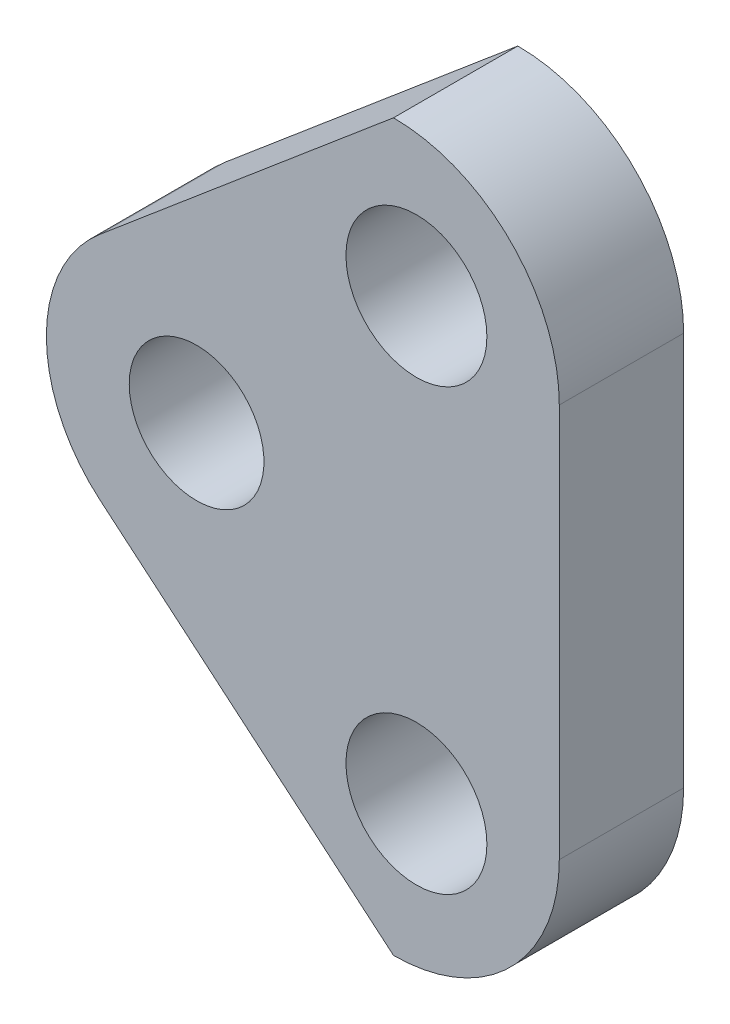
from build123d import *

# Parameters (mm, degrees)
SKETCH_1_R          = 3.4
EXTRUDE_1_DEPTH     = 11
SKETCH_2_R          = 3.4
EXTRUDE_2_DEPTH     = 3
SKETCH_3_R          = 3.4
CUT_EXTRUDE_1_DEPTH = 28.083205128
CUT_EXTRUDE_START   = -5
SKETCH_4_R          = 6
SKETCH_4_R_2        = 3.4
CUT_EXTRUDE_2_DEPTH = 5
CUT_EXTRUDE_3_DEPTH = 28.083205128
CUT_EXTRUDE_5_DEPTH = 28.083205128
CUT_EXTRUDE_6_DEPTH = 5
SKETCH_9_R          = 6
SKETCH_9_R_2        = 3.4
CUT_EXTRUDE_7_DEPTH = 10
CUT_EXTRUDE_8_DEPTH = 10
SKETCH_11_R         = 6
SKETCH_11_R_2       = 3.25
EXTRUDE_3_DEPTH     = 6


with BuildPart() as part:
    # 草图1 → 凸台-拉伸1 (new body)
    with BuildSketch(Plane.XY):
        with BuildLine():
            Line((-9.5, -17.5), (9.5, -17.5))
            ThreePointArc((9.5, -17.5), (15.156854249, -15.156854249), (17.5, -9.5))
            Line((17.5, -9.5), (17.5, 9.5))
            ThreePointArc((17.5, 9.5), (15.156854249, 15.156854249), (9.5, 17.5))
            Line((9.5, 17.5), (-9.5, 17.5))
            ThreePointArc((-9.5, 17.5), (-15.156854249, 15.156854249), (-17.5, 9.5))
            Line((-17.5, 9.5), (-17.5, -9.5))
            ThreePointArc((-17.5, -9.5), (-15.156854249, -15.156854249), (-9.5, -17.5))
        make_face()
        with Locations((10.606601718, 10.606601718)):
            Circle(SKETCH_1_R, mode=Mode.SUBTRACT)
        with Locations((10.606601718, -10.606601718)):
            Circle(SKETCH_1_R, mode=Mode.SUBTRACT)
        with Locations((-10.606601718, -10.606601718)):
            Circle(SKETCH_1_R, mode=Mode.SUBTRACT)
        with Locations((-10.606601718, 10.606601718)):
            Circle(SKETCH_1_R, mode=Mode.SUBTRACT)
    extrude(amount=EXTRUDE_1_DEPTH)

    # 草图2 → 凸台-拉伸2 (add)
    with BuildSketch(Plane(origin=(0, 0, 0), x_dir=(-1, 0, 0), z_dir=(0, 0, -1))):
        with Locations((10.606601718, -10.606601718)):
            Circle(SKETCH_2_R)
        with Locations((-10.606601718, -10.606601718)):
            Circle(SKETCH_2_R)
        with Locations((10.606601718, 10.606601718)):
            Circle(SKETCH_2_R)
        with Locations((-10.606601718, 10.606601718)):
            Circle(SKETCH_2_R)
    extrude(amount=-EXTRUDE_2_DEPTH)

    # 草图3 → 切除-拉伸1 (cut, through all)
    with BuildSketch(Plane.XY.offset(11)):
        Circle(SKETCH_3_R)
    extrude(amount=-CUT_EXTRUDE_1_DEPTH, mode=Mode.SUBTRACT)

    # 草图4 → 切除-拉伸2 (cut)
    with BuildSketch(Plane(origin=(0, 0, 0), x_dir=(-1, 0, 0), z_dir=(0, 0, -1)).offset(CUT_EXTRUDE_START)):
        Circle(SKETCH_4_R)
        with Locations(Location((0, 0, 0), (0, 0, 180))):
            Circle(SKETCH_4_R_2, mode=Mode.SUBTRACT)
    extrude(amount=CUT_EXTRUDE_2_DEPTH, mode=Mode.SUBTRACT)

    # 草图6 → 切除-拉伸3 (cut, through all)
    with BuildSketch(Plane(origin=(0, 0, 0), x_dir=(-1, 0, 0), z_dir=(0, 0, -1))):
        with BuildLine():
            Line((9.5, 17.5), (0, 17.5))
            Line((0, 17.5), (17.5, 0))
            Line((17.5, 0), (17.5, 9.5))
            ThreePointArc((17.5, 9.5), (15.156854249, 15.156854249), (9.5, 17.5))
        make_face()
        with BuildLine():
            Line((17.5, -9.5), (17.5, 0))
            Line((17.5, 0), (0, -17.5))
            Line((0, -17.5), (9.5, -17.5))
            ThreePointArc((9.5, -17.5), (15.156854249, -15.156854249), (17.5, -9.5))
        make_face()
    extrude(amount=-CUT_EXTRUDE_3_DEPTH, mode=Mode.SUBTRACT)

    # 草图7 → 切除-拉伸5 (cut, through all)
    with BuildSketch(Plane.XY.offset(11)):
        with BuildLine():
            Line((-7.222574041, -10.277425959), (0, -17.5))
            ThreePointArc((0, -17.5), (-7.248737342, 0), (0, 17.5))
            Line((0, 17.5), (-7.222574041, 10.277425959))
            ThreePointArc((-7.222574041, 10.277425959), (-8.202438662, 8.202438662), (-10.277425959, 7.222574041))
            Line((-10.277425959, 7.222574041), (-17.5, 0))
            Line((-17.5, 0), (-10.277425959, -7.222574041))
            ThreePointArc((-10.277425959, -7.222574041), (-8.202438662, -8.202438662), (-7.222574041, -10.277425959))
        make_face()
        with BuildLine():
            Line((-10.277425959, -7.222574041), (-7.222574041, -10.277425959))
            ThreePointArc((-7.222574041, -10.277425959), (-8.202438662, -8.202438662), (-10.277425959, -7.222574041))
        make_face()
        with BuildLine():
            ThreePointArc((-10.277425959, 7.222574041), (-8.202438662, 8.202438662), (-7.222574041, 10.277425959))
            Line((-7.222574041, 10.277425959), (-10.277425959, 7.222574041))
        make_face()
    extrude(amount=-CUT_EXTRUDE_5_DEPTH, mode=Mode.SUBTRACT)

    # 草图8 → 切除-拉伸6 (cut)
    with BuildSketch(Plane.XY.offset(11).offset(CUT_EXTRUDE_START)):
        with BuildLine():
            Line((9.5, 17.5), (0, 17.5))
            ThreePointArc((0, 17.5), (-7.248737342, 0), (0, -17.5))
            Line((0, -17.5), (9.5, -17.5))
            ThreePointArc((9.5, -17.5), (15.156854249, -15.156854249), (17.5, -9.5))
            Line((17.5, -9.5), (17.5, 9.5))
            ThreePointArc((17.5, 9.5), (15.156854249, 15.156854249), (9.5, 17.5))
        make_face()
    extrude(amount=CUT_EXTRUDE_6_DEPTH, mode=Mode.SUBTRACT)

    # 草图9 → 切除-拉伸7 (cut)
    with BuildSketch(Plane(origin=(0, 0, 0), x_dir=(-1, 0, 0), z_dir=(0, 0, -1))):
        Circle(SKETCH_9_R)
        with Locations((-10.606601718, 10.606601718)):
            Circle(SKETCH_9_R_2)
        with Locations((-10.606601718, -10.606601718)):
            Circle(SKETCH_9_R_2)
    extrude(amount=-CUT_EXTRUDE_7_DEPTH, mode=Mode.SUBTRACT)

    # 草图10 → 切除-拉伸8 (cut)
    with BuildSketch(Plane.XY.offset(6)):
        with BuildLine():
            Line((-4.674526852, 5.540125608), (9.5, 17.5))
            Line((9.5, 17.5), (0, 17.5))
            ThreePointArc((0, 17.5), (-5.36485188, 9.470931766), (-7.248737342, 3e-08))
            ThreePointArc((-7.248737342, 3e-08), (-6.573758827, 3.054486525), (-4.674526852, 5.540125608))
        make_face()
        with BuildLine():
            ThreePointArc((-4.674526852, -5.540125608), (-6.573758839, -3.054486498), (-7.248737342, 3e-08))
            ThreePointArc((-7.248737342, 3e-08), (-5.364851891, -9.470931739), (0, -17.5))
            Line((0, -17.5), (9.5, -17.5))
            Line((9.5, -17.5), (-4.674526852, -5.540125608))
        make_face()
    extrude(amount=-CUT_EXTRUDE_8_DEPTH, mode=Mode.SUBTRACT)

    # 草图11 → 凸台-拉伸3 (add, through all)
    with BuildSketch(Plane(origin=(0, 0, 0), x_dir=(-1, 0, 0), z_dir=(0, 0, -1))):
        Circle(SKETCH_11_R)
        Circle(SKETCH_11_R_2, mode=Mode.SUBTRACT)
    extrude(amount=-EXTRUDE_3_DEPTH)


solid = part.part
